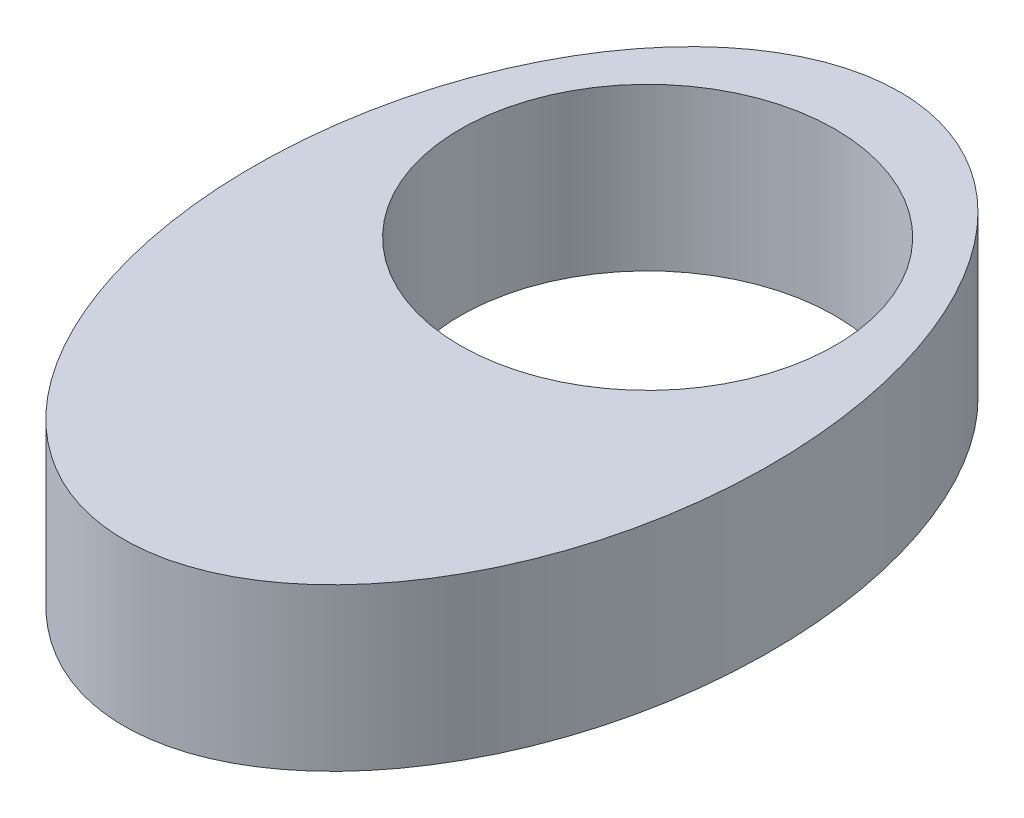
from build123d import *

# Parameters (mm, degrees)
SKETCH1_RX          = 60
SKETCH1_RY          = 40
SKETCH1_RX_2        = 55
SKETCH1_RY_2        = 35
SKETCH1_R           = 29
BOSS_EXTRUDE1_DEPTH = 25


with BuildPart() as part:
    # Sketch1 → Boss-Extrude1 (new body)
    # profile 1 of 2: a face of its own
    with BuildSketch(Plane(origin=(0, 0, 0), x_dir=(1, 0, 0), z_dir=(0, 1, 0))):
        with Locations(Location((0, 0), (0, 0, 90))):
            Ellipse(SKETCH1_RX, SKETCH1_RY)
        with Locations(Location((0, 0), (0, 0, 90))):
            Ellipse(SKETCH1_RX_2, SKETCH1_RY_2, mode=Mode.SUBTRACT)
    # profile 2 of 2: a face of its own
    with BuildSketch(Plane(origin=(0, 0, 0), x_dir=(1, 0, 0), z_dir=(0, 1, 0))):
        with Locations(Location((0, 0), (0, 0, 90))):
            Ellipse(SKETCH1_RX_2, SKETCH1_RY_2)
        with Locations(Location((0, 21, 0), (0, 0, 270))):
            Circle(SKETCH1_R, mode=Mode.SUBTRACT)
    extrude(amount=BOSS_EXTRUDE1_DEPTH)


solid = part.part
